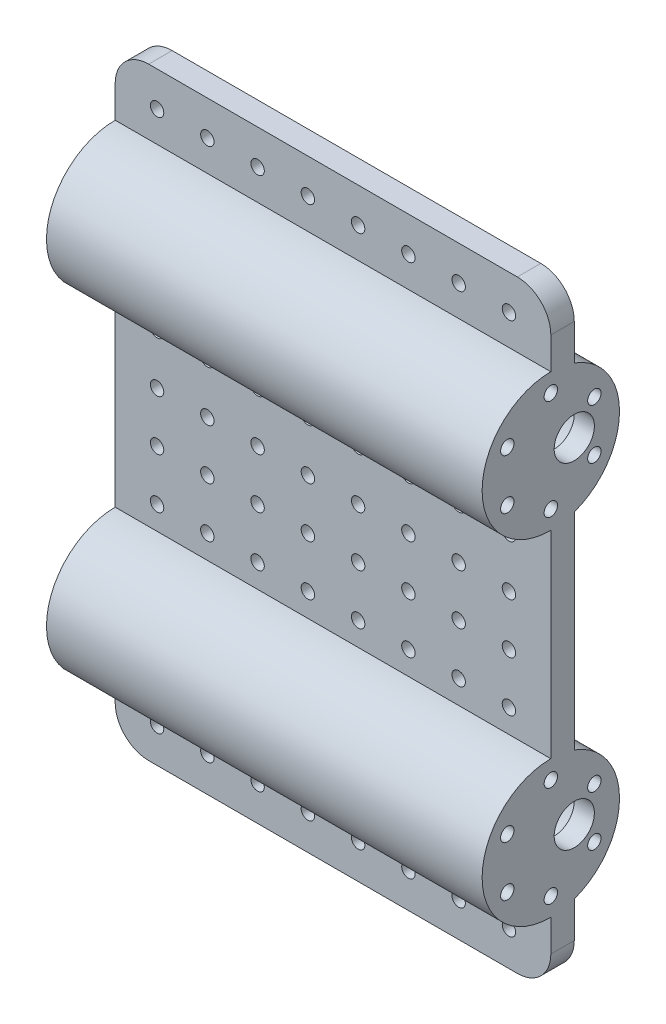
from build123d import *

# Parameters (mm, degrees)
SKIZZE1_W                        = 130
SKIZZE1_H                        = 180
AUFSATZ_LINEAR_AUSTRAGEN1_DEPTH  = 7
SKIZZE2_R                        = 20.5
SKIZZE2_R_2                      = 6
SKIZZE2_R_3                      = 2
AUFSATZ_LINEAR_AUSTRAGEN3_DEPTH  = 6
SKIZZE14_R                       = 20.5
SKIZZE14_R_2                     = 18.5
AUFSATZ_LINEAR_AUSTRAGEN14_DEPTH = 10
AUFSATZ_LINEAR_AUSTRAGEN4_DEPTH  = 59
SCHNITT_LINEAR_START             = 59
SKIZZE10_R                       = 18.5
SCHNITT_LINEAR_AUSTRAGEN3_DEPTH  = 59
SKIZZE11_R                       = 2
SKIZZE11_R_2                     = 6
SCHNITT_LINEAR_AUSTRAGEN4_DEPTH  = 6
SPIEGELN2_COPY_1_SKETCH_R        = 20.5
SPIEGELN2_COPY_1_SKETCH_R_2      = 6
SPIEGELN2_COPY_1_SKETCH_R_3      = 2
SPIEGELN2_COPY_1_DEPTH           = 6
SPIEGELN2_COPY_2_SKETCH_R        = 20.5
SPIEGELN2_COPY_2_SKETCH_R_2      = 18.5
SPIEGELN2_COPY_2_DEPTH           = 10
SPIEGELN2_COPY_3_DEPTH           = 59
SPIEGELN2_START                  = 59
SPIEGELN2_COPY_4_SKETCH_R        = 18.5
SPIEGELN2_COPY_4_DEPTH           = 59
SPIEGELN2_COPY_5_SKETCH_R        = 2
SPIEGELN2_COPY_5_SKETCH_R_2      = 6
SPIEGELN2_COPY_5_DEPTH           = 6
SPIEGELN2_COPY_6_SKETCH_R        = 20.5
SPIEGELN2_COPY_6_SKETCH_R_2      = 18.5
SPIEGELN2_COPY_6_DEPTH           = 10
SKIZZE13_R                       = 2
SCHNITT_LINEAR_AUSTRAGEN6_DEPTH  = 20
VERRUNDUNG1_R                    = 10


with BuildPart() as part:
    # Skizze1 → Aufsatz-Linear austragen1 (new body)
    with BuildSketch(Plane.XY):
        with Locations((65, 90)):
            Rectangle(SKIZZE1_W, SKIZZE1_H)
    extrude(amount=AUFSATZ_LINEAR_AUSTRAGEN1_DEPTH)

    # Skizze2 → Aufsatz-Linear austragen3 (add)
    with BuildSketch(Plane.ZY):
        with Locations((7, 140)):
            Circle(SKIZZE2_R)
        with Locations((0, 140)):
            Circle(SKIZZE2_R_2, mode=Mode.SUBTRACT)
        with Locations(Location((19.990381057, 147.5, 0), (0, 0, 270))):
            Circle(SKIZZE2_R_3, mode=Mode.SUBTRACT)
        with Locations(Location((19.990381057, 132.5, 0), (0, 0, 270))):
            Circle(SKIZZE2_R_3, mode=Mode.SUBTRACT)
        with Locations((7, 125)):
            Circle(SKIZZE2_R_3, mode=Mode.SUBTRACT)
        with Locations((7, 155)):
            Circle(SKIZZE2_R_3, mode=Mode.SUBTRACT)
        with Locations(Location((-5.990381057, 147.5, 0), (0, 0, 270))):
            Circle(SKIZZE2_R_3, mode=Mode.SUBTRACT)
        with Locations(Location((-5.990381057, 132.5, 0), (0, 0, 270))):
            Circle(SKIZZE2_R_3, mode=Mode.SUBTRACT)
    aufsatz_linear_austragen3 = extrude(amount=-AUFSATZ_LINEAR_AUSTRAGEN3_DEPTH)

    # Skizze14 → Aufsatz-Linear austragen14 (add)
    with BuildSketch(Plane(origin=(6, 0, 0), x_dir=(0, 0, -1), z_dir=(1, 0, 0))):
        with Locations((-7, 140)):
            Circle(SKIZZE14_R)
        with Locations((-7, 140)):
            Circle(SKIZZE14_R_2, mode=Mode.SUBTRACT)
    aufsatz_linear_austragen14 = extrude(amount=AUFSATZ_LINEAR_AUSTRAGEN14_DEPTH)

    # Skizze7 → Aufsatz-Linear austragen4 (add)
    with BuildSketch(Plane(origin=(6, 0, 0), x_dir=(0, 0, -1), z_dir=(1, 0, 0))):
        with BuildLine():
            Line((0, 159.267848868), (0, 157.12454379))
            ThreePointArc((0, 157.12454379), (-25.5, 140), (0, 122.87545621))
            Line((0, 122.87545621), (0, 120.732151132))
            ThreePointArc((0, 120.732151132), (-27.5, 140), (0, 159.267848868))
        make_face()
    aufsatz_linear_austragen4 = extrude(amount=AUFSATZ_LINEAR_AUSTRAGEN4_DEPTH)

    # Skizze10 → Schnitt-Linear austragen3 (cut)
    with BuildSketch(Plane.ZY.offset(-65).offset(SCHNITT_LINEAR_START)):
        with Locations(Location((7, 140, 0), (0, 0, 90))):
            Circle(SKIZZE10_R)
    schnitt_linear_austragen3 = extrude(amount=-SCHNITT_LINEAR_AUSTRAGEN3_DEPTH, mode=Mode.SUBTRACT)

    # Skizze11 → Schnitt-Linear austragen4 (cut)
    with BuildSketch(Plane.ZY):
        with Locations(Location((7, 155, 0), (0, 0, 270))):
            Circle(SKIZZE11_R)
        with Locations(Location((7, 125, 0), (0, 0, 270))):
            Circle(SKIZZE11_R)
        with Locations(Location((0, 140, 0), (0, 0, 270))):
            Circle(SKIZZE11_R_2)
    schnitt_linear_austragen4 = extrude(amount=-SCHNITT_LINEAR_AUSTRAGEN4_DEPTH, mode=Mode.SUBTRACT)

    # Spiegeln1: Aufsatz-Linear austragen3, Aufsatz-Linear austragen14, Aufsatz-Linear austragen4, Schnitt-Linear austragen3, Schnitt-Linear austragen4 across plane
    add(aufsatz_linear_austragen3.mirror(Plane.ZY.offset(-65)))
    add(aufsatz_linear_austragen14.mirror(Plane.ZY.offset(-65)))
    add(aufsatz_linear_austragen4.mirror(Plane.ZY.offset(-65)))
    add(schnitt_linear_austragen3.mirror(Plane.ZY.offset(-65)), mode=Mode.SUBTRACT)
    add(schnitt_linear_austragen4.mirror(Plane.ZY.offset(-65)), mode=Mode.SUBTRACT)

    # Spiegeln2: Aufsatz-Linear austragen3, Aufsatz-Linear austragen4, Schnitt-Linear austragen3, Schnitt-Linear austragen4 across plane
    add(aufsatz_linear_austragen3.mirror(Plane(origin=(0, 90, 0), x_dir=(0, 0, 1), z_dir=(0, -1, 0))))
    add(aufsatz_linear_austragen4.mirror(Plane(origin=(0, 90, 0), x_dir=(0, 0, 1), z_dir=(0, -1, 0))))
    add(schnitt_linear_austragen3.mirror(Plane(origin=(0, 90, 0), x_dir=(0, 0, 1), z_dir=(0, -1, 0))), mode=Mode.SUBTRACT)
    add(schnitt_linear_austragen4.mirror(Plane(origin=(0, 90, 0), x_dir=(0, 0, 1), z_dir=(0, -1, 0))), mode=Mode.SUBTRACT)

    # Spiegeln2 copy 1 sketch → Spiegeln2 copy 1 (add)
    with BuildSketch(Plane(origin=(130, 180, 0), x_dir=(0, 0, 1), z_dir=(1, 0, 0))):
        with Locations((7, 140)):
            Circle(SPIEGELN2_COPY_1_SKETCH_R)
        with Locations((0, 140)):
            Circle(SPIEGELN2_COPY_1_SKETCH_R_2, mode=Mode.SUBTRACT)
        with Locations(Location((19.990381057, 147.5, 0), (0, 0, 270))):
            Circle(SPIEGELN2_COPY_1_SKETCH_R_3, mode=Mode.SUBTRACT)
        with Locations(Location((19.990381057, 132.5, 0), (0, 0, 270))):
            Circle(SPIEGELN2_COPY_1_SKETCH_R_3, mode=Mode.SUBTRACT)
        with Locations((7, 125)):
            Circle(SPIEGELN2_COPY_1_SKETCH_R_3, mode=Mode.SUBTRACT)
        with Locations((7, 155)):
            Circle(SPIEGELN2_COPY_1_SKETCH_R_3, mode=Mode.SUBTRACT)
        with Locations(Location((-5.990381057, 147.5, 0), (0, 0, 270))):
            Circle(SPIEGELN2_COPY_1_SKETCH_R_3, mode=Mode.SUBTRACT)
        with Locations(Location((-5.990381057, 132.5, 0), (0, 0, 270))):
            Circle(SPIEGELN2_COPY_1_SKETCH_R_3, mode=Mode.SUBTRACT)
    extrude(amount=-SPIEGELN2_COPY_1_DEPTH)

    # Spiegeln2 copy 2 sketch → Spiegeln2 copy 2 (add)
    with BuildSketch(Plane(origin=(124, 180, 0), x_dir=(0, 0, -1), z_dir=(-1, 0, 0))):
        with Locations((-7, 140)):
            Circle(SPIEGELN2_COPY_2_SKETCH_R)
        with Locations((-7, 140)):
            Circle(SPIEGELN2_COPY_2_SKETCH_R_2, mode=Mode.SUBTRACT)
    extrude(amount=SPIEGELN2_COPY_2_DEPTH)

    # Spiegeln2 copy 3 sketch → Spiegeln2 copy 3 (add)
    with BuildSketch(Plane(origin=(124, 180, 0), x_dir=(0, 0, -1), z_dir=(-1, 0, 0))):
        with BuildLine():
            Line((0, 159.267848868), (0, 157.12454379))
            ThreePointArc((0, 157.12454379), (-25.5, 140), (0, 122.87545621))
            Line((0, 122.87545621), (0, 120.732151132))
            ThreePointArc((0, 120.732151132), (-27.5, 140), (0, 159.267848868))
        make_face()
    extrude(amount=SPIEGELN2_COPY_3_DEPTH)

    # Spiegeln2 copy 4 sketch → Spiegeln2 copy 4 (cut)
    with BuildSketch(Plane(origin=(65, 180, 0), x_dir=(0, 0, 1), z_dir=(1, 0, 0)).offset(SPIEGELN2_START)):
        with Locations(Location((7, 140, 0), (0, 0, 90))):
            Circle(SPIEGELN2_COPY_4_SKETCH_R)
    extrude(amount=-SPIEGELN2_COPY_4_DEPTH, mode=Mode.SUBTRACT)

    # Spiegeln2 copy 5 sketch → Spiegeln2 copy 5 (cut)
    with BuildSketch(Plane(origin=(130, 180, 0), x_dir=(0, 0, 1), z_dir=(1, 0, 0))):
        with Locations(Location((7, 155, 0), (0, 0, 270))):
            Circle(SPIEGELN2_COPY_5_SKETCH_R)
        with Locations(Location((7, 125, 0), (0, 0, 270))):
            Circle(SPIEGELN2_COPY_5_SKETCH_R)
        with Locations(Location((0, 140, 0), (0, 0, 270))):
            Circle(SPIEGELN2_COPY_5_SKETCH_R_2)
    extrude(amount=-SPIEGELN2_COPY_5_DEPTH, mode=Mode.SUBTRACT)

    # Spiegeln2 copy 6 sketch → Spiegeln2 copy 6 (add)
    with BuildSketch(Plane(origin=(6, 180, 0), x_dir=(0, 0, -1), z_dir=(1, 0, 0))):
        with Locations((-7, -140)):
            Circle(SPIEGELN2_COPY_6_SKETCH_R)
        with Locations((-7, -140)):
            Circle(SPIEGELN2_COPY_6_SKETCH_R_2, mode=Mode.SUBTRACT)
    extrude(amount=SPIEGELN2_COPY_6_DEPTH)

    # Skizze13 → Schnitt-Linear austragen6 (cut)
    with BuildSketch(Plane(origin=(0, 0, 0), x_dir=(-1, 0, 0), z_dir=(0, 0, -1))):
        with Locations((-12.5, 112.5)):
            Circle(SKIZZE13_R)
        with Locations((-27.5, 112.5)):
            Circle(SKIZZE13_R)
        with Locations((-42.5, 112.5)):
            Circle(SKIZZE13_R)
        with Locations((-57.5, 112.5)):
            Circle(SKIZZE13_R)
        with Locations((-72.5, 112.5)):
            Circle(SKIZZE13_R)
        with Locations((-87.5, 112.5)):
            Circle(SKIZZE13_R)
        with Locations((-102.5, 112.5)):
            Circle(SKIZZE13_R)
        with Locations((-117.5, 112.5)):
            Circle(SKIZZE13_R)
        with Locations((-27.5, 97.5)):
            Circle(SKIZZE13_R)
        with Locations((-42.5, 97.5)):
            Circle(SKIZZE13_R)
        with Locations((-57.5, 97.5)):
            Circle(SKIZZE13_R)
        with Locations((-72.5, 97.5)):
            Circle(SKIZZE13_R)
        with Locations((-87.5, 97.5)):
            Circle(SKIZZE13_R)
        with Locations((-102.5, 97.5)):
            Circle(SKIZZE13_R)
        with Locations((-117.5, 97.5)):
            Circle(SKIZZE13_R)
        with Locations((-27.5, 82.5)):
            Circle(SKIZZE13_R)
        with Locations((-42.5, 82.5)):
            Circle(SKIZZE13_R)
        with Locations((-57.5, 82.5)):
            Circle(SKIZZE13_R)
        with Locations((-72.5, 82.5)):
            Circle(SKIZZE13_R)
        with Locations((-87.5, 82.5)):
            Circle(SKIZZE13_R)
        with Locations((-102.5, 82.5)):
            Circle(SKIZZE13_R)
        with Locations((-117.5, 82.5)):
            Circle(SKIZZE13_R)
        with Locations((-27.5, 67.5)):
            Circle(SKIZZE13_R)
        with Locations((-42.5, 67.5)):
            Circle(SKIZZE13_R)
        with Locations((-57.5, 67.5)):
            Circle(SKIZZE13_R)
        with Locations((-72.5, 67.5)):
            Circle(SKIZZE13_R)
        with Locations((-87.5, 67.5)):
            Circle(SKIZZE13_R)
        with Locations((-102.5, 67.5)):
            Circle(SKIZZE13_R)
        with Locations((-117.5, 67.5)):
            Circle(SKIZZE13_R)
        with Locations((-12.5, 97.5)):
            Circle(SKIZZE13_R)
        with Locations((-12.5, 82.5)):
            Circle(SKIZZE13_R)
        with Locations((-12.5, 67.5)):
            Circle(SKIZZE13_R)
        with Locations((-117.5, 169.633924434)):
            Circle(SKIZZE13_R)
        with Locations((-102.5, 169.633924434)):
            Circle(SKIZZE13_R)
        with Locations((-87.5, 169.633924434)):
            Circle(SKIZZE13_R)
        with Locations((-72.5, 169.633924434)):
            Circle(SKIZZE13_R)
        with Locations((-57.5, 169.633924434)):
            Circle(SKIZZE13_R)
        with Locations((-42.5, 169.633924434)):
            Circle(SKIZZE13_R)
        with Locations((-27.5, 169.633924434)):
            Circle(SKIZZE13_R)
        with Locations((-12.5, 169.633924434)):
            Circle(SKIZZE13_R)
        with Locations((-12.5, 10.366075566)):
            Circle(SKIZZE13_R)
        with Locations((-27.5, 10.366075566)):
            Circle(SKIZZE13_R)
        with Locations((-42.5, 10.366075566)):
            Circle(SKIZZE13_R)
        with Locations((-57.5, 10.366075566)):
            Circle(SKIZZE13_R)
        with Locations((-72.5, 10.366075566)):
            Circle(SKIZZE13_R)
        with Locations((-87.5, 10.366075566)):
            Circle(SKIZZE13_R)
        with Locations((-102.5, 10.366075566)):
            Circle(SKIZZE13_R)
        with Locations((-117.5, 10.366075566)):
            Circle(SKIZZE13_R)
    extrude(amount=-SCHNITT_LINEAR_AUSTRAGEN6_DEPTH, mode=Mode.SUBTRACT)

    # Verrundung1
    verrundung1_edges = [part.edges().sort_by_distance(p)[0] for p in [
        (0, 180, 3.5),
        (130, 180, 3.5),
        (130, 0, 3.5),
        (0, 0, 3.5),
    ]]
    fillet(verrundung1_edges, radius=VERRUNDUNG1_R)


solid = part.part
